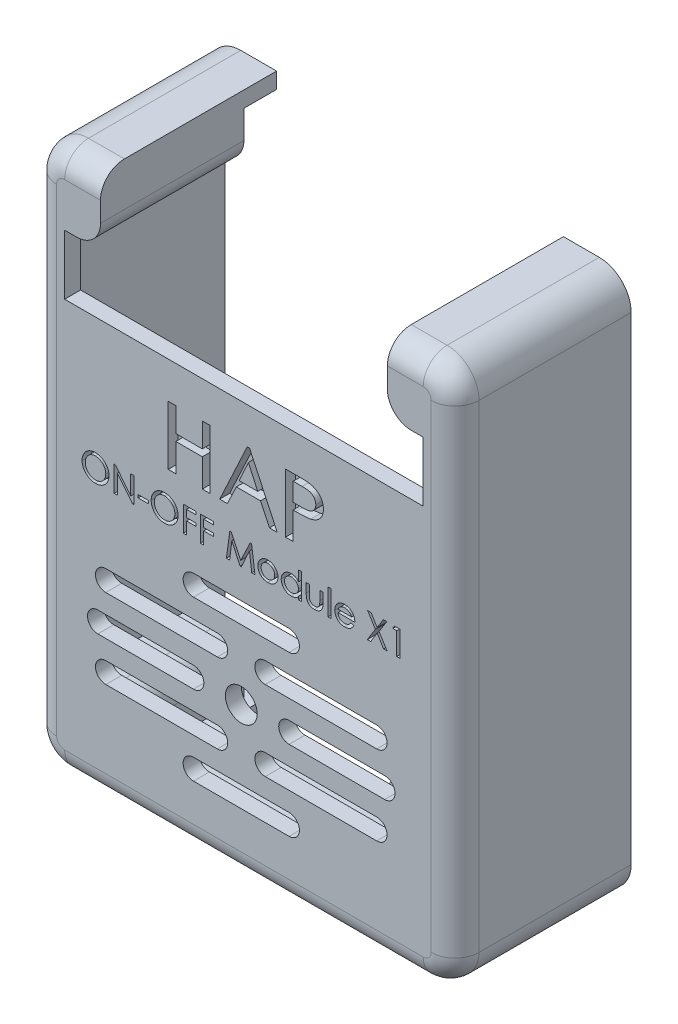
from build123d import *

# Parameters (mm, degrees)
ESBO_O1_W                = 53
ESBO_O1_H                = 68
RESSALTO_EXTRUS_O1_DEPTH = 22.1
FILETE1_R                = 4
FILETE2_R                = 3
CASCA1_T                 = -2
RESSALTO_EXTRUS_O2_DEPTH = 16
ESBO_O4_R                = 1
CORTE_EXTRUS_O1_DEPTH    = 6
CORTE_EXTRUS_O2_DEPTH    = 49.442336855
ESBO_O6_W                = 17
ESBO_O6_H                = 2
CORTE_EXTRUS_O3_DEPTH    = 6
RESSALTO_EXTRUS_O3_DEPTH = 4.5
ESBO_O8_W                = 21
ESBO_O8_H                = 8
RESSALTO_EXTRUS_O4_DEPTH = 1.5
FILETE3_R                = 1
ESBO_O11_W               = 1.302564103
ESBO_O11_H               = 0.366346154
ESBO_O11_W_2             = 0.407051282
ESBO_O11_H_2             = 3.256410256
CORTE_EXTRUS_O5_DEPTH    = 1.25
ESBO_O15_R               = 2
CORTE_EXTRUS_O6_DEPTH    = 53.826697796
CORTE_EXTRUS_O7_DEPTH    = 53.826697796
CORTE_EXTRUS_O8_DEPTH    = 53.826697796


with BuildPart() as part:
    # Esboço1 → Ressalto-extrusão1 (new body)
    with BuildSketch(Plane.XY):
        Rectangle(ESBO_O1_W, ESBO_O1_H)
    extrude(amount=RESSALTO_EXTRUS_O1_DEPTH)

    # Filete1
    filete1_edges = [part.edges().sort_by_distance(p)[0] for p in [
        (26.5, -34, 11.05),
        (-26.5, -34, 11.05),
        (-26.5, 34, 11.05),
        (26.5, 34, 11.05),
    ]]
    fillet(filete1_edges, radius=FILETE1_R)

    # Filete2
    filete2_edges = [part.edges().sort_by_distance(p)[0] for p in [
        (-26.5, 0, 22.1),
        (0, 34, 22.1),
        (26.5, 0, 22.1),
        (0, -34, 22.1),
        (25.328427125, -32.828427125, 22.1),
        (-25.328427125, -32.828427125, 22.1),
        (25.328427125, 32.828427125, 22.1),
        (-25.328427125, 32.828427125, 22.1),
    ]]
    fillet(filete2_edges, radius=FILETE2_R)

    # Casca1
    casca1_openings = [part.faces().sort_by_distance(p)[0] for p in [
        (0, 0, 0),
    ]]
    offset(amount=CASCA1_T, openings=casca1_openings, kind=Kind.INTERSECTION)

    # Esboço3 → Ressalto-extrusão2 (add)
    with BuildSketch(Plane(origin=(0, 0, 20.1), x_dir=(-1, 0, 0), z_dir=(0, 0, -1))):
        with BuildLine():
            Line((-18, -28.5), (-18, -32))
            Line((-18, -32), (-22.5, -32))
            ThreePointArc((-22.5, -32), (-23.914213562, -31.414213562), (-24.5, -30))
            Line((-24.5, -30), (-24.5, -25.5))
            Line((-24.5, -25.5), (-21, -25.5))
            ThreePointArc((-21, -25.5), (-18.878679656, -26.378679656), (-18, -28.5))
        make_face()
        with BuildLine():
            Line((22.5, -32), (18, -32))
            Line((18, -32), (18, -28.5))
            ThreePointArc((18, -28.5), (18.878679656, -26.378679656), (21, -25.5))
            Line((21, -25.5), (24.5, -25.5))
            Line((24.5, -25.5), (24.5, -30))
            ThreePointArc((24.5, -30), (23.914213562, -31.414213562), (22.5, -32))
        make_face()
        with BuildLine():
            Line((18, 28.5), (18, 32))
            Line((18, 32), (22.5, 32))
            ThreePointArc((22.5, 32), (23.914213562, 31.414213562), (24.5, 30))
            Line((24.5, 30), (24.5, 25.5))
            Line((24.5, 25.5), (21, 25.5))
            ThreePointArc((21, 25.5), (18.878679656, 26.378679656), (18, 28.5))
        make_face()
        with BuildLine():
            Line((-22.5, 32), (-18, 32))
            Line((-18, 32), (-18, 28.5))
            ThreePointArc((-18, 28.5), (-18.878679656, 26.378679656), (-21, 25.5))
            Line((-21, 25.5), (-24.5, 25.5))
            Line((-24.5, 25.5), (-24.5, 30))
            ThreePointArc((-24.5, 30), (-23.914213562, 31.414213562), (-22.5, 32))
        make_face()
    extrude(amount=RESSALTO_EXTRUS_O2_DEPTH)

    # Esboço4 → Corte-extrusão1 (cut)
    with BuildSketch(Plane(origin=(0, 0, 4.1), x_dir=(-1, 0, 0), z_dir=(0, 0, -1))):
        with Locations((-21, -28.5)):
            Circle(ESBO_O4_R)
        with Locations(Location((21, -28.5, 0), (0, 0, 180))):
            Circle(ESBO_O4_R)
        with Locations(Location((-21, 28.5, 0), (0, 0, 180))):
            Circle(ESBO_O4_R)
        with Locations((21, 28.5)):
            Circle(ESBO_O4_R)
    extrude(amount=-CORTE_EXTRUS_O1_DEPTH, mode=Mode.SUBTRACT)

    # Esboço5 → Corte-extrusão2 (cut, through all)
    with BuildSketch(Plane.XY.offset(22.1)):
        with BuildLine():
            Line((-18, 34), (18, 34))
            Line((18, 34), (18, 28.5))
            ThreePointArc((18, 28.5), (18.878679656, 26.378679656), (21, 25.5))
            Line((21, 25.5), (22.5, 25.5))
            Line((22.5, 25.5), (22.5, 18))
            Line((22.5, 18), (-22.5, 18))
            Line((-22.5, 18), (-22.5, 25.5))
            Line((-22.5, 25.5), (-21, 25.5))
            ThreePointArc((-21, 25.5), (-18.878679656, 26.378679656), (-18, 28.5))
            Line((-18, 28.5), (-18, 34))
        make_face()
    extrude(amount=-CORTE_EXTRUS_O2_DEPTH, mode=Mode.SUBTRACT)

    # Esboço6 → Corte-extrusão3 (cut)
    with BuildSketch(Plane(origin=(0, 0, 0), x_dir=(-1, 0, 0), z_dir=(0, 0, -1))):
        with Locations((8, -33)):
            Rectangle(ESBO_O6_W, ESBO_O6_H)
    extrude(amount=-CORTE_EXTRUS_O3_DEPTH, mode=Mode.SUBTRACT)

    # Esboço7 → Ressalto-extrusão3 (add)
    with BuildSketch(Plane.XZ.offset(34)):
        Polygon((-16.5, 0), (-18.5, 0), (-18.5, 8), (2.5, 8), (2.5, 0), (0.5, 0), (0.5, 6), (-16.5, 6), align=None)
    extrude(amount=RESSALTO_EXTRUS_O3_DEPTH)

    # Esboço8 → Ressalto-extrusão4 (add)
    with BuildSketch(Plane.XZ.offset(38.5)):
        with Locations((-8, 4)):
            Rectangle(ESBO_O8_W, ESBO_O8_H)
    extrude(amount=RESSALTO_EXTRUS_O4_DEPTH)

    # Filete3
    filete3_edges = [part.edges().sort_by_distance(p)[0] for p in [
        (2.5, -34, 4),
        (-8, -34, 8),
        (2.5, -37, 8),
        (-18.5, -34, 4),
        (-18.5, -37, 8),
        (-18.5, -40, 4),
        (2.5, -40, 4),
        (-8, -40, 8),
    ]]
    fillet(filete3_edges, radius=FILETE3_R)

    # Esboço11 → Corte-extrusão5 (cut)
    # profile 1 of 17: a face of its own
    with BuildSketch(Plane.XY.offset(22.1)):
        Polygon((-9.497863248, 13.408333333), (-8.548076923, 13.408333333), (-8.548076923, 10.369017094), (-5.223824786, 10.369017094), (-5.223824786, 13.408333333), (-4.274038462, 13.408333333), (-4.274038462, 6), (-5.223824786, 6), (-5.223824786, 9.514209402), (-8.548076923, 9.514209402), (-8.548076923, 6), (-9.497863248, 6), align=None)
    # profile 2 of 17: a face of its own
    with BuildSketch(Plane.XY.offset(22.1)):
        Polygon((0.712339744, 13.408333333), (4.179059829, 6), (3.204044805, 6), (2.079141627, 8.374465812), (-0.951270366, 8.374465812), (-2.076173544, 6), (-3.039316239, 6), (0.415531517, 13.408333333), align=None)
        Polygon((0.56393563, 11.789244458), (-0.58916433, 9.229273504), (1.728907919, 9.229273504), align=None, mode=Mode.SUBTRACT)
    # profile 3 of 17: a face of its own
    with BuildSketch(Plane.XY.offset(22.1)):
        with BuildLine():
            Line((5.223824786, 13.408333333), (6.741998865, 13.408333333))
            add(Edge.make_bspline(
                [(6.741998865, 13.408333333), (6.842424822, 13.408278623), (7.034886838, 13.408173773), (7.310897954, 13.401068802), (7.561302187, 13.394936623), (7.786469526, 13.383150051), (7.985887317, 13.367004707), (8.159627149, 13.348019716), (8.307875568, 13.326666846), (8.397280983, 13.307362149), (8.438257879, 13.29851429)],
                knots=[0, 0, 0, 0, 1.415450773, 2.712650385, 3.891531898, 4.945867971, 5.890285756, 6.71109784, 7.409261617, 8, 8, 8, 8], degree=3))
            add(Edge.make_bspline(
                [(8.438257879, 13.29851429), (8.495942574, 13.283680344), (8.609736796, 13.254417517), (8.772409869, 13.194098175), (8.926764641, 13.125557678), (9.072274115, 13.047590545), (9.207451971, 12.957542686), (9.335214601, 12.859707097), (9.451632221, 12.749135392), (9.560693201, 12.63119165), (9.656383934, 12.503181942), (9.742123106, 12.36943773), (9.81318784, 12.228016417), (9.871591028, 12.079444043), (9.917246912, 11.924495232), (9.950087848, 11.762676295), (9.969821611, 11.594342074), (9.971766058, 11.479628522), (9.97275641, 11.421202257)],
                knots=[0, 0, 0, 0, 1.085641105, 2.141637125, 3.15936318, 4.164535163, 5.147931294, 6.118832473, 7.09541784, 8.072503165, 9.045079613, 10.006206652, 10.966486436, 11.926469503, 12.914201526, 13.908586125, 14.934794539, 16, 16, 16, 16], degree=3))
            add(Edge.make_bspline(
                [(9.97275641, 11.421202257), (9.971744331, 11.362778714), (9.969748707, 11.24757889), (9.950139559, 11.078238345), (9.917268861, 10.916083249), (9.872953033, 10.760397252), (9.814712204, 10.612148591), (9.745119235, 10.470085699), (9.66099468, 10.335818116), (9.564956582, 10.208413881), (9.456502164, 10.089830924), (9.33720323, 9.980519339), (9.205491635, 9.882388209), (9.062718232, 9.793676181), (8.909380518, 9.712827643), (8.743935903, 9.643289027), (8.567122515, 9.584035503), (8.444410034, 9.552528781), (8.381864316, 9.536470019)],
                knots=[0, 0, 0, 0, 1.042501879, 2.055610221, 3.037454288, 3.993184118, 4.940927036, 5.876790881, 6.812738028, 7.76458517, 8.720845088, 9.677105007, 10.648370915, 11.647960469, 12.67482723, 13.739162042, 14.847666245, 16, 16, 16, 16], degree=3))
            add(Edge.make_bspline(
                [(8.381864316, 9.536470019), (8.335960628, 9.526517768), (8.235822679, 9.50480714), (8.069649778, 9.482215677), (7.876024426, 9.463707416), (7.65433466, 9.447604886), (7.405489181, 9.434078617), (7.128384218, 9.426026753), (6.823651765, 9.419529496), (6.610912827, 9.41933308), (6.50010016, 9.419230769)],
                knots=[0, 0, 0, 0, 0.596754895, 1.30180848, 2.129432098, 3.068723067, 4.126429569, 5.296393252, 6.591729958, 8, 8, 8, 8], degree=3))
            Line((6.50010016, 9.419230769), (6.173611111, 9.419230769))
            Line((6.173611111, 9.419230769), (6.173611111, 6))
            Line((6.173611111, 6), (5.223824786, 6))
            Line((5.223824786, 6), (5.223824786, 13.408333333))
        make_face()
        with BuildLine():
            Line((6.173611111, 12.553525641), (6.173611111, 10.271070379))
            Line((6.173611111, 10.271070379), (7.242120726, 10.25919805))
            add(Edge.make_bspline(
                [(7.242120726, 10.25919805), (7.302473989, 10.259993888), (7.418755721, 10.261527217), (7.586559348, 10.266851114), (7.740903047, 10.277671577), (7.882084959, 10.290291281), (8.01039029, 10.307984164), (8.125241418, 10.33006574), (8.227617647, 10.354875585), (8.344686321, 10.393882154), (8.475726415, 10.454787823), (8.61503635, 10.547717277), (8.737833254, 10.658854056), (8.839244978, 10.789661827), (8.920856934, 10.933786251), (8.98152116, 11.087828654), (9.015858204, 11.251503707), (9.020579374, 11.36317167), (9.022970085, 11.419718216)],
                knots=[0, 0, 0, 0, 1.196816259, 2.305888068, 3.328295896, 4.264290022, 5.116006351, 5.89509982, 6.582615619, 7.202969204, 8.339503699, 9.435837163, 10.511976311, 11.608836183, 12.702577786, 13.786378287, 14.879063815, 16, 16, 16, 16], degree=3))
            add(Edge.make_bspline(
                [(9.022970085, 11.419718216), (9.020562105, 11.474291432), (9.015785966, 11.582535354), (8.981269433, 11.741734618), (8.920577209, 11.89274005), (8.838832324, 12.03483991), (8.739496932, 12.164721312), (8.621829434, 12.276451432), (8.488662399, 12.367766063), (8.364340726, 12.426251471), (8.253488827, 12.464312692), (8.155788815, 12.486671003), (8.045417653, 12.507575713), (7.921689966, 12.52549693), (7.784490646, 12.538422006), (7.633985082, 12.546712743), (7.470718887, 12.553209836), (7.357388702, 12.553417672), (7.29851429, 12.553525641)],
                knots=[0, 0, 0, 0, 1.113934591, 2.209447376, 3.306634974, 4.424089692, 5.547326231, 6.633252657, 7.723023745, 8.829884498, 9.427152571, 10.113060991, 10.873719268, 11.720735618, 12.664423995, 13.686322671, 14.798057257, 16, 16, 16, 16], degree=3))
            Line((7.29851429, 12.553525641), (6.173611111, 12.553525641))
        make_face(mode=Mode.SUBTRACT)
    # profile 4 of 17: a face of its own
    with BuildSketch(Plane.XY.offset(22.1)):
        with BuildLine():
            add(Edge.make_bspline(
                [(-18.662665264, 3.256410256), (-18.601744117, 3.255003803), (-18.482002384, 3.25223939), (-18.306342018, 3.228669906), (-18.138591903, 3.19096362), (-17.97899947, 3.137105594), (-17.827456977, 3.068097153), (-17.683725345, 2.983805674), (-17.548231396, 2.883975806), (-17.422631712, 2.769887276), (-17.308539955, 2.645610402), (-17.20743021, 2.514241641), (-17.123469959, 2.37519935), (-17.053283392, 2.230495554), (-17.000175872, 2.078787824), (-16.96082889, 1.921361518), (-16.937623022, 1.757161996), (-16.934777204, 1.645450591), (-16.933333333, 1.588772035)],
                knots=[0, 0, 0, 0, 1.090651108, 2.14369656, 3.167927427, 4.165692988, 5.154576575, 6.145033357, 7.14440862, 8.163220312, 9.178978109, 10.162394332, 11.12677451, 12.082874982, 13.037579715, 13.999894772, 14.985214855, 16, 16, 16, 16], degree=3))
            add(Edge.make_bspline(
                [(-16.933333333, 1.588772035), (-16.934749442, 1.532510339), (-16.937540326, 1.42162915), (-16.961192075, 1.2584302), (-16.999322574, 1.101194651), (-17.052721478, 0.949616309), (-17.122770743, 0.80485136), (-17.20715091, 0.665685237), (-17.307652338, 0.533447238), (-17.421318353, 0.408300417), (-17.546229622, 0.293802288), (-17.680351207, 0.193247278), (-17.822056211, 0.10861202), (-17.970638705, 0.038157045), (-18.127314155, -0.014738461), (-18.290912715, -0.053962692), (-18.462078359, -0.077137407), (-18.578640865, -0.079970765), (-18.637860577, -0.081410256)],
                knots=[0, 0, 0, 0, 1.015667565, 2.001689161, 2.971180881, 3.933912672, 4.898051938, 5.870540525, 6.8683264, 7.892867857, 8.919988739, 9.923897136, 10.914753654, 11.896185405, 12.887840524, 13.895451133, 14.930781579, 16, 16, 16, 16], degree=3))
            add(Edge.make_bspline(
                [(-18.637860577, -0.081410256), (-18.695608506, -0.08001429), (-18.809239239, -0.077267443), (-18.975937346, -0.053473597), (-19.135870235, -0.016380647), (-19.288831264, 0.036928962), (-19.435063394, 0.104924402), (-19.573733498, 0.189271151), (-19.706066842, 0.287509193), (-19.829546275, 0.400049536), (-19.942238019, 0.523287882), (-20.041085816, 0.654470412), (-20.125156425, 0.791928327), (-20.193546393, 0.93581885), (-20.246824366, 1.086278638), (-20.283783736, 1.243271526), (-20.307710291, 1.406350047), (-20.310462493, 1.517240975), (-20.311858974, 1.573507612)],
                knots=[0, 0, 0, 0, 1.056734814, 2.079339537, 3.076314658, 4.058285941, 5.039336339, 6.023146808, 7.024524339, 8.052147497, 9.076900738, 10.077495695, 11.054668894, 12.021676166, 12.988994953, 13.970866516, 14.970407042, 16, 16, 16, 16], degree=3))
            add(Edge.make_bspline(
                [(-20.311858974, 1.573507612), (-20.31137443, 1.611274565), (-20.310411454, 1.686332022), (-20.298800992, 1.797787022), (-20.281987499, 1.907461708), (-20.257764583, 2.014986983), (-20.226520877, 2.120381981), (-20.188011654, 2.223425281), (-20.143904677, 2.324987804), (-20.091295619, 2.423053547), (-20.034176915, 2.518192023), (-19.970705614, 2.607848), (-19.903567029, 2.693113205), (-19.829934386, 2.771711496), (-19.752269598, 2.845947091), (-19.669303364, 2.914674489), (-19.581544442, 2.97851468), (-19.488614538, 3.036045974), (-19.392803683, 3.088078907), (-19.294036889, 3.132730157), (-19.193655571, 3.17105337), (-19.091189569, 3.20211469), (-18.986910983, 3.226636608), (-18.880592221, 3.243334708), (-18.772317985, 3.254968196), (-18.699373431, 3.255927501), (-18.662665264, 3.256410256)],
                knots=[0, 0, 0, 0, 1.036913812, 2.060746492, 3.074578145, 4.08324605, 5.085523353, 6.091481477, 7.103103322, 8.124200051, 9.145827961, 10.149052085, 11.139400635, 12.124186929, 13.104469564, 14.088618662, 15.081002312, 16.082788945, 17.088477375, 18.073521874, 19.057670972, 20.037642247, 21.012252997, 21.997331918, 22.992189685, 24, 24, 24, 24], degree=3))
        make_face()
        with BuildLine():
            add(Edge.make_bspline(
                [(-18.649308894, 2.890064103), (-18.676045291, 2.889640879), (-18.72922458, 2.888799077), (-18.808447527, 2.879987574), (-18.886850107, 2.866751425), (-18.964568121, 2.848136194), (-19.041665645, 2.824876076), (-19.117479086, 2.795119858), (-19.19274096, 2.761073605), (-19.266108793, 2.720716006), (-19.337630188, 2.676907928), (-19.405278934, 2.628002028), (-19.469831428, 2.57601705), (-19.530357427, 2.519201621), (-19.586743296, 2.458299566), (-19.639302158, 2.393411059), (-19.688435171, 2.324760531), (-19.733066402, 2.251872138), (-19.774288363, 2.176254421), (-19.808987955, 2.09741784), (-19.838381082, 2.016201204), (-19.862504966, 1.932690025), (-19.881833082, 1.846719095), (-19.894764667, 1.758256544), (-19.903604107, 1.667393823), (-19.904402399, 1.605966367), (-19.904807692, 1.574779647)],
                knots=[0, 0, 0, 0, 0.951425037, 1.892405618, 2.834142553, 3.780555396, 4.735506122, 5.698386817, 6.677778342, 7.674036042, 8.677244726, 9.661625187, 10.643485342, 11.625954439, 12.613944774, 13.595804929, 14.596853729, 15.616869823, 16.636634596, 17.660413109, 18.67984269, 19.709280547, 20.753005387, 21.813969624, 22.890152378, 24, 24, 24, 24], degree=3))
            add(Edge.make_bspline(
                [(-19.904807692, 1.574779647), (-19.903823176, 1.529345534), (-19.901892187, 1.440232945), (-19.88326967, 1.309522063), (-19.854398364, 1.184618348), (-19.813532374, 1.065648211), (-19.76091307, 0.952647655), (-19.696511037, 0.84564932), (-19.620218316, 0.744385092), (-19.53294509, 0.650800902), (-19.438332173, 0.565290942), (-19.337976086, 0.490778533), (-19.234174434, 0.426346025), (-19.125261371, 0.374701394), (-19.012304459, 0.334453921), (-18.895111932, 0.305815049), (-18.773662147, 0.288108006), (-18.691134436, 0.286002819), (-18.649308894, 0.284935897)],
                knots=[0, 0, 0, 0, 1.087324682, 2.132633634, 3.154656843, 4.153212625, 5.138884617, 6.133989092, 7.13811672, 8.169089965, 9.193543553, 10.187520856, 11.158295186, 12.114249704, 13.068004623, 14.02467326, 14.998892505, 16, 16, 16, 16], degree=3))
            add(Edge.make_bspline(
                [(-18.649308894, 0.284935897), (-18.619607662, 0.285360236), (-18.560723002, 0.286201516), (-18.473432999, 0.294890097), (-18.387870147, 0.308286725), (-18.303984031, 0.326320824), (-18.222024394, 0.351193458), (-18.141372747, 0.379807829), (-18.062914368, 0.415492998), (-17.986085632, 0.45497111), (-17.912847897, 0.500372971), (-17.842375799, 0.54863828), (-17.776093457, 0.601154922), (-17.715272161, 0.658972845), (-17.657432349, 0.719472901), (-17.604143961, 0.784352614), (-17.555034344, 0.853188421), (-17.510596075, 0.92575989), (-17.470736586, 1.001197722), (-17.435308403, 1.07894241), (-17.406512684, 1.159108639), (-17.381803014, 1.240912277), (-17.363584397, 1.325188184), (-17.350410936, 1.411426466), (-17.341616432, 1.499760419), (-17.340798567, 1.559281954), (-17.340384615, 1.589408053)],
                knots=[0, 0, 0, 0, 1.036970321, 2.055862331, 3.060095599, 4.060719653, 5.049301004, 6.049377071, 7.046955997, 8.056986028, 9.063944937, 10.053856218, 11.039021426, 12.013303897, 12.982198174, 13.960523328, 14.942567566, 15.933032457, 16.929951754, 17.920776327, 18.913894254, 19.902475604, 20.903099658, 21.921964767, 22.948227815, 24, 24, 24, 24], degree=3))
            add(Edge.make_bspline(
                [(-17.340384615, 1.589408053), (-17.340800464, 1.619322095), (-17.341622016, 1.678420374), (-17.350366756, 1.765913739), (-17.363568962, 1.851096609), (-17.38191567, 1.934278004), (-17.406387591, 2.015093486), (-17.435331492, 2.094161583), (-17.470738373, 2.170641126), (-17.510620479, 2.2447951), (-17.555145139, 2.316403237), (-17.604824465, 2.384122233), (-17.658293266, 2.448735291), (-17.716343497, 2.509290339), (-17.779013444, 2.566008044), (-17.845707949, 2.619313216), (-17.916627764, 2.669411278), (-17.991948202, 2.714527917), (-18.069657951, 2.75598252), (-18.149343623, 2.791334532), (-18.229627047, 2.822274525), (-18.31124847, 2.847130511), (-18.394192431, 2.866082568), (-18.478252988, 2.880222203), (-18.563481287, 2.888721909), (-18.620669289, 2.889616229), (-18.649308894, 2.890064103)],
                knots=[0, 0, 0, 0, 1.048789873, 2.071992723, 3.080474812, 4.070813472, 5.056451928, 6.039816187, 7.021295338, 8.009314668, 8.991328769, 9.975844821, 10.952581135, 11.930703152, 12.91499457, 13.914777939, 14.923479275, 15.957618598, 16.991998452, 18.010408503, 19.012925223, 20.00783076, 20.999814803, 21.994803685, 22.995802798, 24, 24, 24, 24], degree=3))
        make_face(mode=Mode.SUBTRACT)
    # profile 5 of 17: a face of its own
    with BuildSketch(Plane.XY.offset(22.1)):
        Polygon((-16.282051282, 0), (-16.282051282, 3.175), (-16.131315104, 3.175), (-14.206089744, 0.762585136), (-14.206089744, 3.175), (-13.799038462, 3.175), (-13.799038462, 0), (-13.96567508, 0), (-15.875, 2.406054687), (-15.875, 0), align=None)
    # profile 6 of 17: a face of its own
    with BuildSketch(Plane.XY.offset(22.1)):
        with Locations((-12.618589743, 1.200801282)):
            Rectangle(ESBO_O11_W, ESBO_O11_H)
    # profile 7 of 17: a face of its own
    with BuildSketch(Plane.XY.offset(22.1)):
        with BuildLine():
            add(Edge.make_bspline(
                [(-9.992472957, 3.256410256), (-9.931551809, 3.255003803), (-9.811810076, 3.25223939), (-9.63614971, 3.228669906), (-9.468399595, 3.19096362), (-9.308807162, 3.137105594), (-9.157264669, 3.068097153), (-9.013533038, 2.983805674), (-8.878039088, 2.883975806), (-8.752439404, 2.769887276), (-8.638347648, 2.645610402), (-8.537237903, 2.514241641), (-8.453277651, 2.37519935), (-8.383091084, 2.230495554), (-8.329983564, 2.078787824), (-8.290636583, 1.921361518), (-8.267430714, 1.757161996), (-8.264584896, 1.645450591), (-8.263141026, 1.588772035)],
                knots=[0, 0, 0, 0, 1.090651108, 2.14369656, 3.167927427, 4.165692988, 5.154576575, 6.145033357, 7.14440862, 8.163220312, 9.178978109, 10.162394332, 11.12677451, 12.082874982, 13.037579715, 13.999894772, 14.985214855, 16, 16, 16, 16], degree=3))
            add(Edge.make_bspline(
                [(-8.263141026, 1.588772035), (-8.264557135, 1.532510339), (-8.267348019, 1.42162915), (-8.290999767, 1.2584302), (-8.329130267, 1.101194651), (-8.38252917, 0.949616309), (-8.452578435, 0.80485136), (-8.536958602, 0.665685237), (-8.63746003, 0.533447238), (-8.751126045, 0.408300417), (-8.876037314, 0.293802288), (-9.0101589, 0.193247278), (-9.151863904, 0.10861202), (-9.300446397, 0.038157045), (-9.457121847, -0.014738461), (-9.620720407, -0.053962692), (-9.791886052, -0.077137407), (-9.908448557, -0.079970765), (-9.967668269, -0.081410256)],
                knots=[0, 0, 0, 0, 1.015667565, 2.001689161, 2.971180881, 3.933912672, 4.898051938, 5.870540525, 6.8683264, 7.892867857, 8.919988739, 9.923897136, 10.914753654, 11.896185405, 12.887840524, 13.895451133, 14.930781579, 16, 16, 16, 16], degree=3))
            add(Edge.make_bspline(
                [(-9.967668269, -0.081410256), (-10.025416198, -0.08001429), (-10.139046931, -0.077267443), (-10.305745038, -0.053473597), (-10.465677927, -0.016380647), (-10.618638956, 0.036928962), (-10.764871086, 0.104924402), (-10.90354119, 0.189271151), (-11.035874534, 0.287509193), (-11.159353967, 0.400049536), (-11.272045712, 0.523287882), (-11.370893509, 0.654470412), (-11.454964117, 0.791928327), (-11.523354085, 0.93581885), (-11.576632059, 1.086278638), (-11.613591428, 1.243271526), (-11.637517983, 1.406350047), (-11.640270185, 1.517240975), (-11.641666667, 1.573507612)],
                knots=[0, 0, 0, 0, 1.056734814, 2.079339537, 3.076314658, 4.058285941, 5.039336339, 6.023146808, 7.024524339, 8.052147497, 9.076900738, 10.077495695, 11.054668894, 12.021676166, 12.988994953, 13.970866516, 14.970407042, 16, 16, 16, 16], degree=3))
            add(Edge.make_bspline(
                [(-11.641666667, 1.573507612), (-11.641182122, 1.611274565), (-11.640219147, 1.686332022), (-11.628608685, 1.797787022), (-11.611795191, 1.907461708), (-11.587572275, 2.014986983), (-11.556328569, 2.120381981), (-11.517819347, 2.223425281), (-11.47371237, 2.324987804), (-11.421103311, 2.423053547), (-11.363984607, 2.518192023), (-11.300513306, 2.607848), (-11.233374721, 2.693113205), (-11.159742078, 2.771711496), (-11.08207729, 2.845947091), (-10.999111057, 2.914674489), (-10.911352134, 2.97851468), (-10.81842223, 3.036045974), (-10.722611375, 3.088078907), (-10.623844581, 3.132730157), (-10.523463264, 3.17105337), (-10.420997261, 3.20211469), (-10.316718675, 3.226636608), (-10.210399914, 3.243334708), (-10.102125677, 3.254968196), (-10.029181123, 3.255927501), (-9.992472957, 3.256410256)],
                knots=[0, 0, 0, 0, 1.036913812, 2.060746492, 3.074578145, 4.08324605, 5.085523353, 6.091481477, 7.103103322, 8.124200051, 9.145827961, 10.149052085, 11.139400635, 12.124186929, 13.104469564, 14.088618662, 15.081002312, 16.082788945, 17.088477375, 18.073521874, 19.057670972, 20.037642247, 21.012252997, 21.997331918, 22.992189685, 24, 24, 24, 24], degree=3))
        make_face()
        with BuildLine():
            add(Edge.make_bspline(
                [(-9.979116587, 2.890064103), (-10.005852983, 2.889640879), (-10.059032273, 2.888799077), (-10.138255219, 2.879987574), (-10.216657799, 2.866751425), (-10.294375813, 2.848136194), (-10.371473337, 2.824876076), (-10.447286779, 2.795119858), (-10.522548652, 2.761073605), (-10.595916486, 2.720716006), (-10.667437881, 2.676907928), (-10.735086626, 2.628002028), (-10.79963912, 2.57601705), (-10.860165119, 2.519201621), (-10.916550989, 2.458299566), (-10.96910985, 2.393411059), (-11.018242863, 2.324760531), (-11.062874094, 2.251872138), (-11.104096055, 2.176254421), (-11.138795648, 2.09741784), (-11.168188775, 2.016201204), (-11.192312658, 1.932690025), (-11.211640774, 1.846719095), (-11.224572359, 1.758256544), (-11.233411799, 1.667393823), (-11.234210092, 1.605966367), (-11.234615385, 1.574779647)],
                knots=[0, 0, 0, 0, 0.951425037, 1.892405618, 2.834142553, 3.780555396, 4.735506122, 5.698386817, 6.677778342, 7.674036042, 8.677244726, 9.661625187, 10.643485342, 11.625954439, 12.613944774, 13.595804929, 14.596853729, 15.616869823, 16.636634596, 17.660413109, 18.67984269, 19.709280547, 20.753005387, 21.813969624, 22.890152378, 24, 24, 24, 24], degree=3))
            add(Edge.make_bspline(
                [(-11.234615385, 1.574779647), (-11.233630869, 1.529345534), (-11.231699879, 1.440232945), (-11.213077363, 1.309522063), (-11.184206057, 1.184618348), (-11.143340066, 1.065648211), (-11.090720762, 0.952647655), (-11.026318729, 0.84564932), (-10.950026008, 0.744385092), (-10.862752783, 0.650800902), (-10.768139866, 0.565290942), (-10.667783778, 0.490778533), (-10.563982126, 0.426346025), (-10.455069064, 0.374701394), (-10.342112151, 0.334453921), (-10.224919625, 0.305815049), (-10.103469839, 0.288108006), (-10.020942128, 0.286002819), (-9.979116587, 0.284935897)],
                knots=[0, 0, 0, 0, 1.087324682, 2.132633634, 3.154656843, 4.153212625, 5.138884617, 6.133989092, 7.13811672, 8.169089965, 9.193543553, 10.187520856, 11.158295186, 12.114249704, 13.068004623, 14.02467326, 14.998892505, 16, 16, 16, 16], degree=3))
            add(Edge.make_bspline(
                [(-9.979116587, 0.284935897), (-9.949415354, 0.285360236), (-9.890530694, 0.286201516), (-9.803240692, 0.294890097), (-9.717677839, 0.308286725), (-9.633791723, 0.326320824), (-9.551832087, 0.351193458), (-9.471180439, 0.379807829), (-9.392722061, 0.415492998), (-9.315893324, 0.45497111), (-9.24265559, 0.500372971), (-9.172183491, 0.54863828), (-9.10590115, 0.601154922), (-9.045079854, 0.658972845), (-8.987240041, 0.719472901), (-8.933951654, 0.784352614), (-8.884842037, 0.853188421), (-8.840403768, 0.92575989), (-8.800544278, 1.001197722), (-8.765116095, 1.07894241), (-8.736320376, 1.159108639), (-8.711610707, 1.240912277), (-8.693392089, 1.325188184), (-8.680218629, 1.411426466), (-8.671424124, 1.499760419), (-8.67060626, 1.559281954), (-8.670192308, 1.589408053)],
                knots=[0, 0, 0, 0, 1.036970321, 2.055862331, 3.060095599, 4.060719653, 5.049301004, 6.049377071, 7.046955997, 8.056986028, 9.063944937, 10.053856218, 11.039021426, 12.013303897, 12.982198174, 13.960523328, 14.942567566, 15.933032457, 16.929951754, 17.920776327, 18.913894254, 19.902475604, 20.903099658, 21.921964767, 22.948227815, 24, 24, 24, 24], degree=3))
            add(Edge.make_bspline(
                [(-8.670192308, 1.589408053), (-8.670608156, 1.619322095), (-8.671429709, 1.678420374), (-8.680174448, 1.765913739), (-8.693376655, 1.851096609), (-8.711723363, 1.934278004), (-8.736195283, 2.015093486), (-8.765139184, 2.094161583), (-8.800546066, 2.170641126), (-8.840428171, 2.2447951), (-8.884952831, 2.316403237), (-8.934632157, 2.384122233), (-8.988100958, 2.448735291), (-9.04615119, 2.509290339), (-9.108821136, 2.566008044), (-9.175515642, 2.619313216), (-9.246435456, 2.669411278), (-9.321755895, 2.714527917), (-9.399465644, 2.75598252), (-9.479151315, 2.791334532), (-9.559434739, 2.822274525), (-9.641056162, 2.847130511), (-9.724000124, 2.866082568), (-9.80806068, 2.880222203), (-9.893288979, 2.888721909), (-9.950476981, 2.889616229), (-9.979116587, 2.890064103)],
                knots=[0, 0, 0, 0, 1.048789873, 2.071992723, 3.080474812, 4.070813472, 5.056451928, 6.039816187, 7.021295338, 8.009314668, 8.991328769, 9.975844821, 10.952581135, 11.930703152, 12.91499457, 13.914777939, 14.923479275, 15.957618598, 16.991998452, 18.010408503, 19.012925223, 20.00783076, 20.999814803, 21.994803685, 22.995802798, 24, 24, 24, 24], degree=3))
        make_face(mode=Mode.SUBTRACT)
    # profile 8 of 17: a face of its own
    with BuildSketch(Plane.XY.offset(22.1)):
        Polygon((-7.611858974, 3.175), (-5.983653846, 3.175), (-5.983653846, 2.808653846), (-7.204807692, 2.808653846), (-7.204807692, 1.913141026), (-5.983653846, 1.913141026), (-5.983653846, 1.546794872), (-7.204807692, 1.546794872), (-7.204807692, 0), (-7.611858974, 0), align=None)
    # profile 9 of 17: a face of its own
    with BuildSketch(Plane.XY.offset(22.1)):
        Polygon((-5.454487179, 3.175), (-3.826282051, 3.175), (-3.826282051, 2.808653846), (-5.047435897, 2.808653846), (-5.047435897, 1.913141026), (-3.826282051, 1.913141026), (-3.826282051, 1.546794872), (-5.047435897, 1.546794872), (-5.047435897, 0), (-5.454487179, 0), align=None)
    # profile 10 of 17: a face of its own
    with BuildSketch(Plane.XY.offset(22.1)):
        Polygon((-2.198076923, 0), (-1.773853165, 3.175), (-1.613576723, 3.175), (-0.409595353, 0.651282051), (0.794386018, 3.175), (0.95720653, 3.175), (1.383974359, 0), (0.980103165, 0), (0.697711338, 2.238782051), (-0.33263722, 0), (-0.486553486, 0), (-1.513721955, 2.238782051), (-1.794841747, 0), align=None)
    # profile 11 of 17: a face of its own
    with BuildSketch(Plane.XY.offset(22.1)):
        with BuildLine():
            add(Edge.make_bspline(
                [(2.993098958, 2.401602564), (3.040215907, 2.400312272), (3.132461998, 2.397786125), (3.267442352, 2.380013481), (3.395619907, 2.349134112), (3.51736203, 2.306870062), (3.63216769, 2.251498262), (3.740323634, 2.184507946), (3.841443174, 2.104596516), (3.902353802, 2.043322575), (3.933133013, 2.012359776)],
                knots=[0, 0, 0, 0, 1.078775739, 2.112039281, 3.110494877, 4.093081892, 5.057110616, 6.022958758, 7.000966324, 8, 8, 8, 8], degree=3))
            add(Edge.make_bspline(
                [(3.933133013, 2.012359776), (3.960427909, 1.981670159), (4.014091803, 1.92133198), (4.083431366, 1.824003633), (4.142482509, 1.723882977), (4.190256469, 1.6202152), (4.228335767, 1.513474356), (4.254744035, 1.403238674), (4.271373968, 1.2897167), (4.273143099, 1.212943641), (4.274038462, 1.174088542)],
                knots=[0, 0, 0, 0, 1.062178036, 2.088324843, 3.086640365, 4.066023852, 5.037709567, 6.014384934, 6.995073642, 8, 8, 8, 8], degree=3))
            add(Edge.make_bspline(
                [(4.274038462, 1.174088542), (4.272919388, 1.135019044), (4.270701539, 1.057588729), (4.253534117, 0.943207647), (4.226383527, 0.831873227), (4.187326659, 0.724093744), (4.137061383, 0.619752254), (4.076758372, 0.518214054), (4.004052295, 0.420830593), (3.922305206, 0.327319516), (3.831461042, 0.241051538), (3.732319942, 0.165524746), (3.626097295, 0.101608979), (3.512984905, 0.048997482), (3.392443324, 0.00924246), (3.265640264, -0.020198617), (3.131597443, -0.037585474), (3.040003547, -0.039648611), (2.993098958, -0.040705128)],
                knots=[0, 0, 0, 0, 0.952871876, 1.888459614, 2.815544184, 3.744891397, 4.679563604, 5.637601804, 6.621431805, 7.640342292, 8.664856555, 9.672479278, 10.67487095, 11.683873433, 12.709444777, 13.765907845, 14.855937143, 16, 16, 16, 16], degree=3))
            add(Edge.make_bspline(
                [(2.993098958, -0.040705128), (2.948302992, -0.039676254), (2.860489929, -0.037659362), (2.732168186, -0.019753772), (2.609803956, 0.007572178), (2.494289604, 0.048225196), (2.38467353, 0.099062594), (2.281689015, 0.162116277), (2.184542831, 0.23588615), (2.095769133, 0.321238261), (2.014854482, 0.412994842), (1.944621858, 0.510406628), (1.884215184, 0.611208887), (1.835105427, 0.716254261), (1.797471915, 0.82550498), (1.769916936, 0.938059462), (1.753825962, 1.054902203), (1.751500439, 1.133970688), (1.750320513, 1.174088542)],
                knots=[0, 0, 0, 0, 1.108842573, 2.173652473, 3.202745058, 4.208988794, 5.200203338, 6.189803525, 7.193715926, 8.215010613, 9.234454675, 10.219573757, 11.184848795, 12.140854958, 13.08565054, 14.042002664, 15.006549187, 16, 16, 16, 16], degree=3))
            add(Edge.make_bspline(
                [(1.750320513, 1.174088542), (1.751281506, 1.213780198), (1.753174853, 1.291980615), (1.768695252, 1.407285151), (1.795028562, 1.518075925), (1.830527737, 1.625249554), (1.877404188, 1.727990002), (1.934393881, 1.826877), (2.000981452, 1.922275662), (2.052887419, 1.980833152), (2.079141627, 2.010451723)],
                knots=[0, 0, 0, 0, 1.034079547, 2.037341334, 3.024980457, 3.998111168, 4.974764182, 5.962233312, 6.969290918, 8, 8, 8, 8], degree=3))
            add(Edge.make_bspline(
                [(2.079141627, 2.010451723), (2.109684244, 2.041651743), (2.16989726, 2.103160789), (2.270121096, 2.182907163), (2.375862446, 2.250901598), (2.48818514, 2.305576422), (2.605778298, 2.34950618), (2.729797316, 2.379782384), (2.859641232, 2.397780981), (2.948096107, 2.4003139), (2.993098958, 2.401602564)],
                knots=[0, 0, 0, 0, 1.021997278, 2.014808882, 2.992991082, 3.961403697, 4.935644248, 5.92819495, 6.945935601, 8, 8, 8, 8], degree=3))
        make_face()
        with BuildLine():
            add(Edge.make_bspline(
                [(2.991826923, 2.03525641), (2.964649524, 2.034532214), (2.910687347, 2.033094285), (2.831205479, 2.021327818), (2.753952625, 2.002300359), (2.679776508, 1.974675721), (2.607557508, 1.940153262), (2.538509345, 1.89715412), (2.471075864, 1.847423381), (2.407711967, 1.789836524), (2.348758183, 1.727144817), (2.297679497, 1.659157748), (2.25398311, 1.587781525), (2.218988693, 1.512115201), (2.191339007, 1.432672428), (2.171992109, 1.349300564), (2.159240472, 1.262038841), (2.158003224, 1.202543773), (2.157371795, 1.172180489)],
                knots=[0, 0, 0, 0, 0.976916649, 1.939720157, 2.882730922, 3.833047911, 4.780976627, 5.756404754, 6.753607, 7.790049989, 8.831165002, 9.84360893, 10.842529111, 11.835057585, 12.835634664, 13.861933882, 14.908838789, 16, 16, 16, 16], degree=3))
            add(Edge.make_bspline(
                [(2.157371795, 1.172180489), (2.158817531, 1.132635282), (2.161662777, 1.054809265), (2.184912557, 0.940813923), (2.2218112, 0.831868507), (2.273329355, 0.729394583), (2.336308707, 0.635642878), (2.409720977, 0.553568379), (2.490759188, 0.482517765), (2.58098789, 0.425461425), (2.677313489, 0.380803994), (2.778432287, 0.349012041), (2.88377409, 0.329142681), (2.955486068, 0.326818719), (2.991826923, 0.325641026)],
                knots=[0, 0, 0, 0, 1.073737222, 2.11314337, 3.147909503, 4.191315005, 5.220292011, 6.207728104, 7.175628903, 8.139268678, 9.098074859, 10.052770626, 11.013219503, 12, 12, 12, 12], degree=3))
            add(Edge.make_bspline(
                [(2.991826923, 0.325641026), (3.031139143, 0.326984228), (3.108605951, 0.32963108), (3.222066734, 0.350667926), (3.330421532, 0.384445001), (3.43291109, 0.431520386), (3.528026761, 0.491158461), (3.61308014, 0.563538526), (3.687622109, 0.64746064), (3.75144883, 0.741004815), (3.80299164, 0.842500728), (3.839996595, 0.949020415), (3.862442098, 1.059520151), (3.865460581, 1.13434023), (3.866987179, 1.172180489)],
                knots=[0, 0, 0, 0, 1.042880454, 2.055051067, 3.051726387, 4.048830532, 5.040201766, 6.022282375, 7.002717173, 8.011000956, 9.020163719, 10.014978664, 10.996075346, 12, 12, 12, 12], degree=3))
            add(Edge.make_bspline(
                [(3.866987179, 1.172180489), (3.866323855, 1.201480462), (3.865015358, 1.259278584), (3.852526432, 1.3443156), (3.832257146, 1.42619922), (3.803454086, 1.50456373), (3.7669794, 1.579681735), (3.722101791, 1.651233003), (3.668980256, 1.719558595), (3.608422863, 1.783552678), (3.542778163, 1.842392382), (3.473416009, 1.894354668), (3.400478746, 1.937511182), (3.324977298, 1.973879594), (3.245846641, 2.000904542), (3.163900003, 2.020703403), (3.078928087, 2.033310531), (3.021127929, 2.034601813), (2.991826923, 2.03525641)],
                knots=[0, 0, 0, 0, 1.02928639, 2.030405262, 3.013559112, 3.98951401, 4.959304921, 5.943474834, 6.952548865, 7.996299005, 9.035918103, 10.047849461, 11.03697177, 12.01024899, 12.98822153, 13.969594738, 14.97071361, 16, 16, 16, 16], degree=3))
        make_face(mode=Mode.SUBTRACT)
    # profile 12 of 17: a face of its own
    with BuildSketch(Plane.XY.offset(22.1)):
        with BuildLine():
            Line((7.245512821, 3.256410256), (7.245512821, 0))
            Line((7.245512821, 0), (6.838461538, 0))
            Line((6.838461538, 0), (6.838461538, 0.393694912))
            add(Edge.make_bspline(
                [(6.838461538, 0.393694912), (6.830743516, 0.376775467), (6.815279401, 0.342875043), (6.7858401, 0.294895926), (6.750361904, 0.250340055), (6.710289519, 0.207961856), (6.66416137, 0.169340528), (6.612986961, 0.133392571), (6.556046542, 0.101254355), (6.473642854, 0.061408927), (6.363775954, 0.020227783), (6.225057487, -0.014489723), (6.080429133, -0.037043422), (5.981618784, -0.039472869), (5.931500401, -0.040705128)],
                knots=[0, 0, 0, 0, 0.630608355, 1.263510136, 1.903889635, 2.560231196, 3.239051379, 3.941510257, 4.679392285, 5.454752425, 7.046003483, 8.649370513, 10.300500544, 12, 12, 12, 12], degree=3))
            add(Edge.make_bspline(
                [(5.931500401, -0.040705128), (5.889044346, -0.039592355), (5.805500055, -0.03740266), (5.682574493, -0.020458305), (5.564433662, 0.007278858), (5.45110373, 0.047374869), (5.34221379, 0.097329818), (5.238315238, 0.159095866), (5.139348623, 0.232047344), (5.046332869, 0.3153225), (4.960798384, 0.40609748), (4.885891088, 0.50317602), (4.822696343, 0.605317961), (4.770681244, 0.712220064), (4.730542708, 0.823997705), (4.70190174, 0.940564787), (4.684240229, 1.062032226), (4.682151143, 1.144771592), (4.681089744, 1.186808894)],
                knots=[0, 0, 0, 0, 1.044896397, 2.056129067, 3.048614574, 4.027447711, 5.010571044, 5.993389545, 6.997607611, 8.032642259, 9.062836233, 10.063957202, 11.045957733, 12.014678412, 12.985421592, 13.963920723, 14.965531344, 16, 16, 16, 16], degree=3))
            add(Edge.make_bspline(
                [(4.681089744, 1.186808894), (4.682181416, 1.227992665), (4.68433514, 1.309242757), (4.701658446, 1.42873925), (4.731536445, 1.543336918), (4.771136475, 1.653970278), (4.824082745, 1.759408463), (4.887774155, 1.860368463), (4.963805508, 1.956149857), (5.049278137, 2.046912588), (5.143480655, 2.129636865), (5.243391726, 2.202531509), (5.348361759, 2.263810442), (5.457464673, 2.314524106), (5.571594297, 2.353395066), (5.690188524, 2.381421442), (5.813777112, 2.398282148), (5.897738988, 2.400483789), (5.940404647, 2.401602564)],
                knots=[0, 0, 0, 0, 1.016034841, 2.00450138, 2.971397661, 3.934621156, 4.89856897, 5.876820612, 6.875287917, 7.911527682, 8.949482881, 9.964547477, 10.958729259, 11.944200774, 12.928602415, 13.928548892, 14.947381472, 16, 16, 16, 16], degree=3))
            add(Edge.make_bspline(
                [(5.940404647, 2.401602564), (5.992009096, 2.399989506), (6.093467215, 2.396818114), (6.241878088, 2.372548812), (6.382188525, 2.33064714), (6.49243713, 2.283292537), (6.573953205, 2.237591364), (6.629504916, 2.20066756), (6.679395958, 2.1614158), (6.723115672, 2.118850246), (6.761416434, 2.073951098), (6.793464443, 2.025944768), (6.819340208, 1.975032584), (6.832055946, 1.939372921), (6.838461538, 1.921409255)],
                knots=[0, 0, 0, 0, 1.714476436, 3.370786067, 4.980251515, 6.570527442, 7.346543759, 8.083216037, 8.785213491, 9.452854217, 10.107771807, 10.742834115, 11.366698768, 12, 12, 12, 12], degree=3))
            Line((6.838461538, 1.921409255), (6.838461538, 3.256410256))
            Line((6.838461538, 3.256410256), (7.245512821, 3.256410256))
        make_face()
        with BuildLine():
            add(Edge.make_bspline(
                [(5.944220753, 2.03525641), (5.907441446, 2.034169695), (5.834364264, 2.032010489), (5.72698597, 2.010498372), (5.62303927, 1.977544797), (5.523795693, 1.930993061), (5.431005907, 1.872081309), (5.346420587, 1.800624895), (5.272033616, 1.716411565), (5.206707778, 1.622381844), (5.154080879, 1.519974085), (5.116261115, 1.411691761), (5.092416362, 1.29915097), (5.089573339, 1.222330776), (5.088141026, 1.183628806)],
                knots=[0, 0, 0, 0, 0.985345119, 1.9577923, 2.925239377, 3.9045943, 4.88888884, 5.865218326, 6.8639424, 7.89390404, 8.928923022, 9.941392206, 10.962874575, 12, 12, 12, 12], degree=3))
            add(Edge.make_bspline(
                [(5.088141026, 1.183628806), (5.089613623, 1.145149883), (5.092544586, 1.068563947), (5.116004751, 0.95574924), (5.155726236, 0.847272471), (5.208527203, 0.743580249), (5.274424887, 0.648573891), (5.349156801, 0.56327805), (5.433891257, 0.490885598), (5.526814926, 0.431345278), (5.625540333, 0.384083903), (5.728113748, 0.350291956), (5.834018899, 0.329851468), (5.905546761, 0.327054049), (5.941676683, 0.325641026)],
                knots=[0, 0, 0, 0, 1.031333656, 2.052699155, 3.074222885, 4.121835995, 5.16426796, 6.16712537, 7.155044458, 8.142292555, 9.118824853, 10.082511977, 11.031444683, 12, 12, 12, 12], degree=3))
            add(Edge.make_bspline(
                [(5.941676683, 0.325641026), (5.981193298, 0.327003902), (6.059938642, 0.329719727), (6.176165348, 0.351038827), (6.288504201, 0.387630054), (6.396623448, 0.435651048), (6.496444652, 0.497141733), (6.585802993, 0.568515805), (6.662535948, 0.650311249), (6.726025086, 0.741489037), (6.777005857, 0.840586042), (6.812083234, 0.946869293), (6.834930553, 1.059057001), (6.837267282, 1.136024158), (6.838461538, 1.175360577)],
                knots=[0, 0, 0, 0, 1.031892719, 2.056267863, 3.073853818, 4.112456973, 5.139224612, 6.127824176, 7.091682251, 8.058066784, 9.021542931, 9.991775944, 10.973635704, 12, 12, 12, 12], degree=3))
            add(Edge.make_bspline(
                [(6.838461538, 1.175360577), (6.837798482, 1.205293923), (6.836494908, 1.26414314), (6.824122803, 1.3504878), (6.803618103, 1.432851153), (6.775742822, 1.512021707), (6.738495947, 1.586686506), (6.694330503, 1.658452681), (6.64118882, 1.725648592), (6.581105733, 1.788814639), (6.515367326, 1.846668845), (6.444604608, 1.896810505), (6.370397307, 1.939815286), (6.292530123, 1.975162437), (6.21043928, 2.001559118), (6.125222956, 2.021561569), (6.035914281, 2.033142984), (5.975206727, 2.03454222), (5.944220753, 2.03525641)],
                knots=[0, 0, 0, 0, 1.037465343, 2.039665814, 3.016719567, 3.977036933, 4.943608494, 5.904404071, 6.894097402, 7.908064747, 8.923948958, 9.925502152, 10.910268881, 11.89404733, 12.884368405, 13.89545364, 14.925810466, 16, 16, 16, 16], degree=3))
        make_face(mode=Mode.SUBTRACT)
    # profile 13 of 17: a face of its own
    with BuildSketch(Plane.XY.offset(22.1)):
        with BuildLine():
            Line((7.815384615, 2.360897436), (8.222435897, 2.360897436))
            Line((8.222435897, 2.360897436), (8.222435897, 1.265039062))
            add(Edge.make_bspline(
                [(8.222435897, 1.265039062), (8.222555367, 1.234085689), (8.22278451, 1.174716603), (8.224580132, 1.089469433), (8.22800686, 1.012315335), (8.231191361, 0.943107186), (8.237399738, 0.882103889), (8.243065521, 0.828709675), (8.251309661, 0.783516316), (8.258141353, 0.75640817), (8.261232973, 0.744140625)],
                knots=[0, 0, 0, 0, 1.418944939, 2.721560048, 3.90822129, 4.959445687, 5.896519748, 6.718644391, 7.420134194, 8, 8, 8, 8], degree=3))
            add(Edge.make_bspline(
                [(8.261232973, 0.744140625), (8.272855742, 0.711214163), (8.295321855, 0.647569298), (8.346473315, 0.562008363), (8.408213947, 0.488371822), (8.482657875, 0.429006967), (8.565696082, 0.381973978), (8.65721913, 0.350313897), (8.755037322, 0.328547442), (8.822922234, 0.326627794), (8.857817508, 0.325641026)],
                knots=[0, 0, 0, 0, 1.064698082, 2.057997224, 3.027713519, 3.985869738, 4.951769774, 5.929245647, 6.93555818, 8, 8, 8, 8], degree=3))
            add(Edge.make_bspline(
                [(8.857817508, 0.325641026), (8.89586648, 0.326928095), (8.969366503, 0.329414355), (9.075057201, 0.350126587), (9.171773461, 0.384191883), (9.257759866, 0.433376981), (9.333954727, 0.491878454), (9.396514538, 0.561199625), (9.448845651, 0.63739492), (9.471148054, 0.694417082), (9.482386819, 0.723152043)],
                knots=[0, 0, 0, 0, 1.152522955, 2.226353534, 3.250900004, 4.246517978, 5.217118907, 6.149589309, 7.067529598, 8, 8, 8, 8], degree=3))
            add(Edge.make_bspline(
                [(9.482386819, 0.723152043), (9.486030763, 0.735176992), (9.494117402, 0.761862755), (9.501335505, 0.807435061), (9.509497688, 0.861391582), (9.51444629, 0.924740292), (9.519997757, 0.996985606), (9.522692361, 1.078458647), (9.52470603, 1.168777328), (9.524898995, 1.231964439), (9.525, 1.265039062)],
                knots=[0, 0, 0, 0, 0.552623276, 1.226381414, 2.027670893, 2.955584593, 4.022320098, 5.218031084, 6.543807858, 8, 8, 8, 8], degree=3))
            Line((9.525, 1.265039062), (9.525, 2.360897436))
            Line((9.525, 2.360897436), (9.932051282, 2.360897436))
            Line((9.932051282, 2.360897436), (9.932051282, 1.209705529))
            add(Edge.make_bspline(
                [(9.932051282, 1.209705529), (9.93163396, 1.171964845), (9.930822372, 1.098568442), (9.926039683, 0.992027664), (9.916809227, 0.892368055), (9.905609507, 0.799618903), (9.888311164, 0.714105924), (9.870061185, 0.635224126), (9.846974421, 0.56337358), (9.820126191, 0.497888816), (9.789327297, 0.437563711), (9.754567754, 0.381214817), (9.716333687, 0.327485588), (9.673969055, 0.276702882), (9.626953228, 0.229543181), (9.576771002, 0.18465933), (9.521885802, 0.143519685), (9.463383646, 0.105258394), (9.400857779, 0.070599337), (9.334091602, 0.041101579), (9.263915792, 0.01522735), (9.189491322, -0.004712556), (9.111463067, -0.021536316), (9.029397001, -0.032785282), (8.943564949, -0.038998994), (8.885176266, -0.04012729), (8.855273437, -0.040705128)],
                knots=[0, 0, 0, 0, 1.433126784, 2.78708125, 4.047948649, 5.23317835, 6.332013834, 7.359028814, 8.306074614, 9.194073739, 10.043734443, 10.874888521, 11.705886645, 12.545920784, 13.382708552, 14.23240739, 15.100217466, 15.98441358, 16.885165303, 17.811245298, 18.753488952, 19.72218431, 20.734230158, 21.782757764, 22.864474903, 24, 24, 24, 24], degree=3))
            add(Edge.make_bspline(
                [(8.855273437, -0.040705128), (8.827058222, -0.040476684), (8.771806662, -0.040029341), (8.690951637, -0.03248435), (8.613390587, -0.021922717), (8.539198802, -0.006770673), (8.468383714, 0.012884285), (8.401221207, 0.03718688), (8.337410626, 0.065840041), (8.277045654, 0.09886135), (8.220455027, 0.135889331), (8.167270234, 0.175967881), (8.118298064, 0.219974518), (8.073092927, 0.267399056), (8.030640603, 0.317395951), (7.993422127, 0.37201722), (7.958885377, 0.429176583), (7.927821304, 0.490422723), (7.900822694, 0.557378391), (7.878318907, 0.631557804), (7.85857622, 0.712854458), (7.842957309, 0.801908647), (7.830265569, 0.898232048), (7.821488404, 1.002437433), (7.816581581, 1.114042836), (7.815791466, 1.191044144), (7.815384615, 1.230694111)],
                knots=[0, 0, 0, 0, 1.07579807, 2.106647768, 3.094742466, 4.060581056, 4.992547774, 5.895540969, 6.78231141, 7.658099749, 8.517151737, 9.359794672, 10.195893314, 11.025198922, 11.857652707, 12.69437682, 13.543128465, 14.403853537, 15.310857085, 16.293043939, 17.358059167, 18.500139289, 19.739904812, 21.062881797, 22.487601799, 24, 24, 24, 24], degree=3))
            Line((7.815384615, 1.230694111), (7.815384615, 2.360897436))
        make_face()
    # profile 14 of 17: a face of its own
    with BuildSketch(Plane.XY.offset(22.1)):
        with Locations((10.746153846, 1.628205128)):
            Rectangle(ESBO_O11_W_2, ESBO_O11_H_2)
    # profile 15 of 17: a face of its own
    with BuildSketch(Plane.XY.offset(22.1)):
        with BuildLine():
            Line((13.460041066, 0.814102564), (13.799038462, 0.651918069))
            add(Edge.make_bspline(
                [(13.799038462, 0.651918069), (13.777606656, 0.612968461), (13.735870123, 0.537117566), (13.664652219, 0.432376169), (13.587362779, 0.340261971), (13.504753031, 0.2597555), (13.415792351, 0.190875758), (13.322081907, 0.129768046), (13.221634109, 0.078529548), (13.115738161, 0.034732575), (13.003003987, 0.001029179), (12.88357038, -0.022914201), (12.75719328, -0.03782928), (12.670573299, -0.039731268), (12.626221955, -0.040705128)],
                knots=[0, 0, 0, 0, 1.110387997, 2.162381809, 3.158716456, 4.110235088, 5.03849693, 5.965639636, 6.901458115, 7.851707839, 8.825366416, 9.836184406, 10.892078622, 12, 12, 12, 12], degree=3))
            add(Edge.make_bspline(
                [(12.626221955, -0.040705128), (12.579303606, -0.039738527), (12.487655168, -0.037850407), (12.354439833, -0.019290762), (12.228738762, 0.008794787), (12.11100731, 0.049471494), (12.001699899, 0.102896254), (11.899512234, 0.16668688), (11.805645294, 0.242825964), (11.720995455, 0.330031369), (11.645800864, 0.424214268), (11.578596698, 0.521664168), (11.52362859, 0.623358784), (11.477202473, 0.727335302), (11.441465145, 0.834715141), (11.416144944, 0.945027568), (11.400244504, 1.058506329), (11.398379925, 1.13523911), (11.397435897, 1.174088542)],
                knots=[0, 0, 0, 0, 1.164566152, 2.274817246, 3.333639364, 4.359360714, 5.360157823, 6.349126428, 7.344925074, 8.35392925, 9.361228562, 10.335284257, 11.289572886, 12.22779236, 13.160187688, 14.095091993, 15.035554391, 16, 16, 16, 16], degree=3))
            add(Edge.make_bspline(
                [(11.397435897, 1.174088542), (11.39826245, 1.210385729), (11.399901897, 1.282380316), (11.413884816, 1.388705736), (11.435201025, 1.492215253), (11.465906551, 1.592485662), (11.505645799, 1.689693444), (11.554120599, 1.783973805), (11.611364032, 1.875300383), (11.655594615, 1.932571299), (11.677919671, 1.961478365)],
                knots=[0, 0, 0, 0, 1.021096707, 2.025320431, 3.012923591, 3.992437812, 4.971861174, 5.964497656, 6.972595394, 8, 8, 8, 8], degree=3))
            add(Edge.make_bspline(
                [(11.677919671, 1.961478365), (11.708110025, 1.996551721), (11.767616351, 2.065682628), (11.869026793, 2.155598899), (11.977706067, 2.232103715), (12.094370236, 2.293860697), (12.218154326, 2.342929123), (12.349765196, 2.376855064), (12.488814008, 2.397670861), (12.583958316, 2.400272823), (12.632582131, 2.401602564)],
                knots=[0, 0, 0, 0, 1.018725525, 2.007946416, 2.977291296, 3.940674949, 4.909614547, 5.904411593, 6.929042575, 8, 8, 8, 8], degree=3))
            add(Edge.make_bspline(
                [(12.632582131, 2.401602564), (12.685029736, 2.400394071), (12.787426669, 2.398034651), (12.936395075, 2.375705441), (13.076903867, 2.34043498), (13.208600255, 2.2899366), (13.33175049, 2.22518074), (13.446321718, 2.146431802), (13.5525327, 2.053227561), (13.613969835, 1.980953321), (13.645122196, 1.944305889)],
                knots=[0, 0, 0, 0, 1.092510559, 2.132980742, 3.131821249, 4.106721871, 5.065344059, 6.025034973, 6.998572742, 8, 8, 8, 8], degree=3))
            add(Edge.make_bspline(
                [(13.645122196, 1.944305889), (13.666933969, 1.915894665), (13.710417758, 1.859254259), (13.764894156, 1.766444327), (13.812273869, 1.668972274), (13.851304934, 1.565568953), (13.880654521, 1.45635782), (13.903356322, 1.342120277), (13.916446893, 1.222294978), (13.91914443, 1.140621112), (13.920517829, 1.099038462)],
                knots=[0, 0, 0, 0, 0.947891001, 1.889708495, 2.844047414, 3.816063809, 4.811874475, 5.836031954, 6.898258033, 8, 8, 8, 8], degree=3))
            Line((13.920517829, 1.099038462), (11.803851162, 1.099038462))
            add(Edge.make_bspline(
                [(11.803851162, 1.099038462), (11.804943111, 1.072054802), (11.807087452, 1.019065022), (11.820599859, 0.941676596), (11.839349269, 0.867440253), (11.86562358, 0.796471193), (11.89888537, 0.728724607), (11.939003012, 0.664244907), (11.986583333, 0.603521991), (12.040286613, 0.546726159), (12.098881755, 0.495050957), (12.160790112, 0.44964906), (12.225545517, 0.410849735), (12.293552535, 0.380057655), (12.364157124, 0.35534771), (12.437576988, 0.338663064), (12.513700093, 0.327016102), (12.565542694, 0.326104227), (12.591877003, 0.325641026)],
                knots=[0, 0, 0, 0, 1.056285998, 2.074305788, 3.068874036, 4.051103373, 5.031155672, 6.019259974, 7.018838325, 8.046424154, 9.075617995, 10.073437039, 11.048590896, 12.025474346, 12.991505956, 13.972050267, 14.969869311, 16, 16, 16, 16], degree=3))
            add(Edge.make_bspline(
                [(12.591877003, 0.325641026), (12.620110233, 0.326171899), (12.676339008, 0.327229177), (12.759586381, 0.338201201), (12.841642989, 0.35357981), (12.921125875, 0.376884573), (12.997433382, 0.404163274), (13.068182242, 0.436723457), (13.132751712, 0.472934965), (13.193616231, 0.514826303), (13.254252563, 0.56734867), (13.318134313, 0.634887556), (13.387841102, 0.718592672), (13.434876699, 0.780813822), (13.460041066, 0.814102564)],
                knots=[0, 0, 0, 0, 0.974501181, 1.940798391, 2.895710587, 3.855187413, 4.797895034, 5.692306932, 6.541458453, 7.351844759, 8.239729442, 9.306468335, 10.558942083, 12, 12, 12, 12], degree=3))
        make_face()
        with BuildLine():
            add(Edge.make_bspline(
                [(13.514102564, 1.465384615), (13.503787915, 1.491680152), (13.483216081, 1.544124731), (13.443609799, 1.618575327), (13.396714029, 1.688104052), (13.343840547, 1.753771113), (13.282292096, 1.814188197), (13.211075135, 1.868107855), (13.130974844, 1.916998351), (13.04196825, 1.957994982), (12.947571755, 1.992198439), (12.849658479, 2.017264427), (12.749223486, 2.032211543), (12.68139318, 2.034236132), (12.647210537, 2.03525641)],
                knots=[0, 0, 0, 0, 0.917468198, 1.829825112, 2.733739057, 3.639830069, 4.565591991, 5.528900948, 6.536885056, 7.609579627, 8.708054817, 9.795976896, 10.889296829, 12, 12, 12, 12], degree=3))
            add(Edge.make_bspline(
                [(12.647210537, 2.03525641), (12.621110406, 2.034597961), (12.56939518, 2.033293298), (12.492974224, 2.024328189), (12.418888136, 2.009100552), (12.347171411, 1.987301223), (12.277877748, 1.959227268), (12.210613702, 1.925278262), (12.145631182, 1.885355787), (12.104863719, 1.854343466), (12.084334936, 1.838726963)],
                knots=[0, 0, 0, 0, 1.030056501, 2.040970785, 3.032161429, 4.011555994, 4.995123754, 5.979296403, 6.982458509, 8, 8, 8, 8], degree=3))
            add(Edge.make_bspline(
                [(12.084334936, 1.838726963), (12.058268227, 1.815780682), (12.004920984, 1.768819601), (11.938696177, 1.680669795), (11.879120068, 1.579606485), (11.849265918, 1.504456825), (11.83374399, 1.465384615)],
                knots=[0, 0, 0, 0, 0.913853049, 1.870260628, 2.892694598, 4, 4, 4, 4], degree=3))
            Line((11.83374399, 1.465384615), (13.514102564, 1.465384615))
        make_face(mode=Mode.SUBTRACT)
    # profile 16 of 17: a face of its own
    with BuildSketch(Plane.XY.offset(22.1)):
        Polygon((15.52900641, 3.175), (15.955774239, 3.175), (16.725991587, 1.916957131), (17.496208934, 3.175), (17.930608974, 3.175), (16.956229968, 1.619300881), (17.971314103, 0), (17.536914062, 0), (16.725991587, 1.321008614), (15.915069111, 0), (15.488301282, 0), (16.503385417, 1.618664864), align=None)
    # profile 17 of 17: a face of its own
    with BuildSketch(Plane.XY.offset(22.1)):
        Polygon((18.888451522, 3.175), (19.579166667, 3.175), (19.579166667, 0), (19.172115385, 0), (19.172115385, 2.808653846), (18.683653846, 2.808653846), align=None)
    extrude(amount=-CORTE_EXTRUS_O5_DEPTH, mode=Mode.SUBTRACT)

    # Esboço15 → Corte-extrusão6 (cut, through all)
    with BuildSketch(Plane.XY.offset(22.1)):
        with Locations((-0.33263722, -14.996311296)):
            Circle(ESBO_O15_R)
        with BuildLine():
            Line((-18.33263722, -13.696311296), (-6.33263722, -13.696311296))
            ThreePointArc((-6.33263722, -13.696311296), (-5.03263722, -14.996311296), (-6.33263722, -16.296311296))
            Line((-6.33263722, -16.296311296), (-18.33263722, -16.296311296))
            ThreePointArc((-18.33263722, -16.296311296), (-19.63263722, -14.996311296), (-18.33263722, -13.696311296))
        make_face()
        with BuildLine():
            Line((17.66736278, -16.296311296), (5.66736278, -16.296311296))
            ThreePointArc((5.66736278, -16.296311296), (4.36736278, -14.996311296), (5.66736278, -13.696311296))
            Line((5.66736278, -13.696311296), (17.66736278, -13.696311296))
            ThreePointArc((17.66736278, -13.696311296), (18.96736278, -14.996311296), (17.66736278, -16.296311296))
        make_face()
    extrude(amount=-CORTE_EXTRUS_O6_DEPTH, mode=Mode.SUBTRACT)

    # Esboço16 → Corte-extrusão7 (cut, through all)
    with BuildSketch(Plane.XY.offset(22.1)):
        with BuildLine():
            Line((-17.33263722, -8.696311296), (-3.33263722, -8.696311296))
            ThreePointArc((-3.33263722, -8.696311296), (-2.03263722, -9.996311296), (-3.33263722, -11.296311296))
            Line((-3.33263722, -11.296311296), (-17.33263722, -11.296311296))
            ThreePointArc((-17.33263722, -11.296311296), (-18.63263722, -9.996311296), (-17.33263722, -8.696311296))
        make_face()
        with BuildLine():
            Line((16.66736278, -11.296311296), (2.66736278, -11.296311296))
            ThreePointArc((2.66736278, -11.296311296), (1.36736278, -9.996311296), (2.66736278, -8.696311296))
            Line((2.66736278, -8.696311296), (16.66736278, -8.696311296))
            ThreePointArc((16.66736278, -8.696311296), (17.96736278, -9.996311296), (16.66736278, -11.296311296))
        make_face()
        with BuildLine():
            Line((16.66736278, -21.296311296), (2.66736278, -21.296311296))
            ThreePointArc((2.66736278, -21.296311296), (1.36736278, -19.996311296), (2.66736278, -18.696311296))
            Line((2.66736278, -18.696311296), (16.66736278, -18.696311296))
            ThreePointArc((16.66736278, -18.696311296), (17.96736278, -19.996311296), (16.66736278, -21.296311296))
        make_face()
        with BuildLine():
            Line((-17.33263722, -18.696311296), (-3.33263722, -18.696311296))
            ThreePointArc((-3.33263722, -18.696311296), (-2.03263722, -19.996311296), (-3.33263722, -21.296311296))
            Line((-3.33263722, -21.296311296), (-17.33263722, -21.296311296))
            ThreePointArc((-17.33263722, -21.296311296), (-18.63263722, -19.996311296), (-17.33263722, -18.696311296))
        make_face()
    extrude(amount=-CORTE_EXTRUS_O7_DEPTH, mode=Mode.SUBTRACT)

    # Esboço17 → Corte-extrusão8 (cut, through all)
    with BuildSketch(Plane.XY.offset(22.1)):
        with BuildLine():
            Line((-6.33263722, -6.296311296), (5.66736278, -6.296311296))
            ThreePointArc((5.66736278, -6.296311296), (6.96736278, -4.996311296), (5.66736278, -3.696311296))
            Line((5.66736278, -3.696311296), (-6.33263722, -3.696311296))
            ThreePointArc((-6.33263722, -3.696311296), (-7.63263722, -4.996311296), (-6.33263722, -6.296311296))
        make_face()
        with BuildLine():
            Line((-6.33263722, -26.296311296), (5.66736278, -26.296311296))
            ThreePointArc((5.66736278, -26.296311296), (6.96736278, -24.996311296), (5.66736278, -23.696311296))
            Line((5.66736278, -23.696311296), (-6.33263722, -23.696311296))
            ThreePointArc((-6.33263722, -23.696311296), (-7.63263722, -24.996311296), (-6.33263722, -26.296311296))
        make_face()
    extrude(amount=-CORTE_EXTRUS_O8_DEPTH, mode=Mode.SUBTRACT)


solid = part.part
